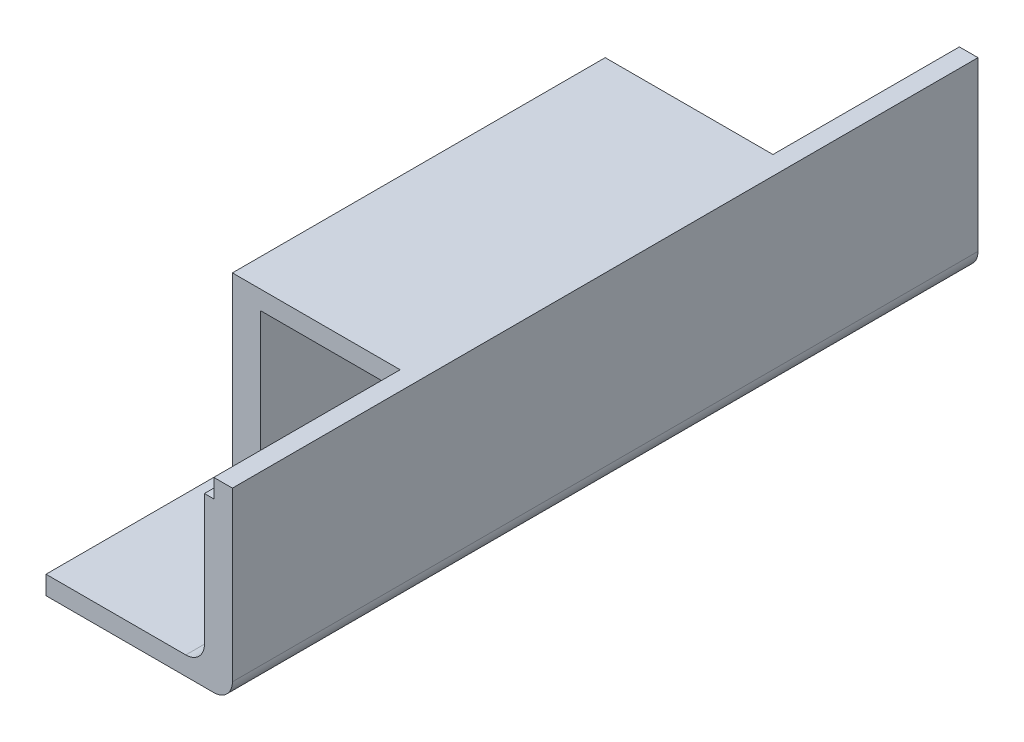
from build123d import *

# Parameters (mm, degrees)
CROQUIS1_W              = 20
CROQUIS1_H              = 80
SALIENTE_EXTRUIR1_DEPTH = 2
CROQUIS2_W              = 3
CROQUIS2_H              = 80
SALIENTE_EXTRUIR2_DEPTH = 16
REDONDEO1_R             = 2
REDONDEO2_R             = 2
CROQUIS3_W              = 20
CROQUIS3_H              = 80
SALIENTE_EXTRUIR3_DEPTH = 2
CROQUIS5_R              = 2.1
CORTAR_EXTRUIR1_DEPTH   = 2
CROQUIS6_W              = 18
CROQUIS6_H              = 20
CORTAR_EXTRUIR3_DEPTH   = 2
CROQUIS7_W              = 3
CROQUIS7_H              = 40
SALIENTE_EXTRUIR4_DEPTH = 16


with BuildPart() as part:
    # Croquis1 → Saliente-Extruir1 (new body)
    with BuildSketch(Plane(origin=(0, 0, 0), x_dir=(1, 0, 0), z_dir=(0, 1, 0))):
        Rectangle(CROQUIS1_W, CROQUIS1_H)
    extrude(amount=SALIENTE_EXTRUIR1_DEPTH)

    # Croquis2 → Saliente-Extruir2 (add)
    with BuildSketch(Plane(origin=(0, 2, 0), x_dir=(1, 0, 0), z_dir=(0, 1, 0))):
        with Locations((8.5, 0)):
            Rectangle(CROQUIS2_W, CROQUIS2_H)
    extrude(amount=SALIENTE_EXTRUIR2_DEPTH)

    # Redondeo1
    redondeo1_edges = [part.edges().sort_by_distance(p)[0] for p in [
        (10, 0, 0),
    ]]
    fillet(redondeo1_edges, radius=REDONDEO1_R)

    # Redondeo2
    redondeo2_edges = [part.edges().sort_by_distance(p)[0] for p in [
        (7, 2, 0),
    ]]
    fillet(redondeo2_edges, radius=REDONDEO2_R)

    # Croquis3 → Saliente-Extruir3 (add)
    with BuildSketch(Plane(origin=(0, 18, 0), x_dir=(1, 0, 0), z_dir=(0, 1, 0))):
        Rectangle(CROQUIS3_W, CROQUIS3_H)
    extrude(amount=SALIENTE_EXTRUIR3_DEPTH)

    # Croquis5 → Cortar-Extruir1 (cut)
    with BuildSketch(Plane(origin=(0, 2, 0), x_dir=(1, 0, 0), z_dir=(0, 1, 0))):
        with Locations(Location((0, 30, 0), (0, 0, 270))):
            Circle(CROQUIS5_R)
        with Locations(Location((0, -30, 0), (0, 0, 270))):
            Circle(CROQUIS5_R)
    extrude(amount=-CORTAR_EXTRUIR1_DEPTH, mode=Mode.SUBTRACT)

    # Croquis6 → Cortar-Extruir3 (cut)
    with BuildSketch(Plane(origin=(0, 20, 0), x_dir=(1, 0, 0), z_dir=(0, 1, 0))):
        with Locations((-1, 30)):
            Rectangle(CROQUIS6_W, CROQUIS6_H)
        with Locations((-1, -30)):
            Rectangle(CROQUIS6_W, CROQUIS6_H)
    extrude(amount=-CORTAR_EXTRUIR3_DEPTH, mode=Mode.SUBTRACT)

    # Croquis7 → Saliente-Extruir4 (add)
    with BuildSketch(Plane(origin=(0, 2, 0), x_dir=(1, 0, 0), z_dir=(0, 1, 0))):
        with Locations((-8.5, 0)):
            Rectangle(CROQUIS7_W, CROQUIS7_H)
    extrude(amount=SALIENTE_EXTRUIR4_DEPTH)


solid = part.part
